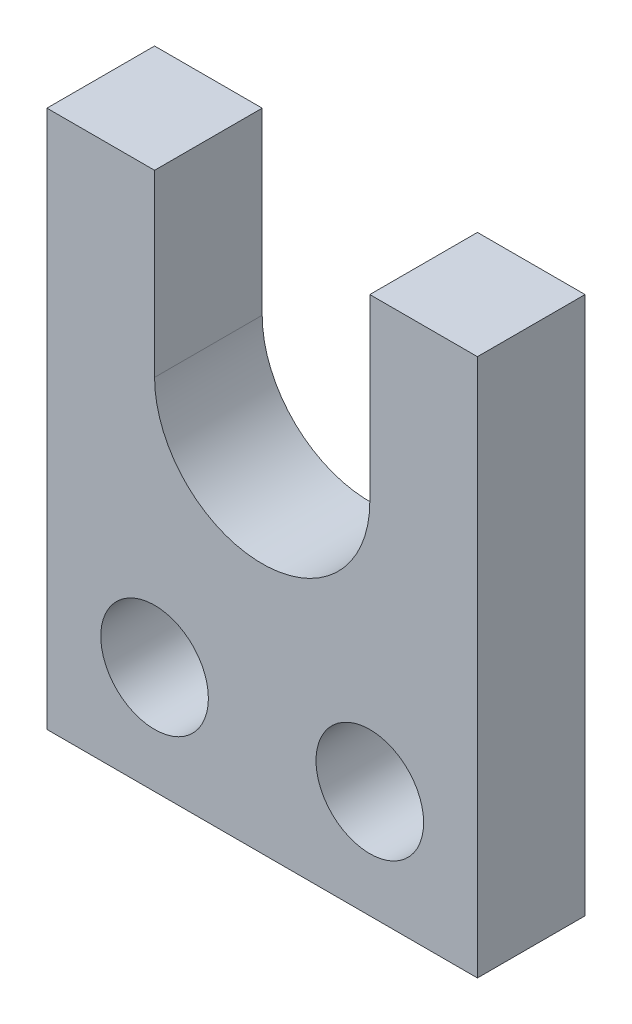
from build123d import *

# Parameters (mm, degrees)
SKETCH1_W           = 12
SKETCH1_H           = 15
SKETCH1_R           = 1.5
BOSS_EXTRUDE1_DEPTH = 3
CUT_EXTRUDE1_REACH  = 12.062


with BuildPart() as part:
    # Sketch1 → Boss-Extrude1 (new body)
    with BuildSketch(Plane.XY):
        Rectangle(SKETCH1_W, SKETCH1_H)
        with Locations((-3, -4.5)):
            Circle(SKETCH1_R, mode=Mode.SUBTRACT)
        with Locations((3, -4.5)):
            Circle(SKETCH1_R, mode=Mode.SUBTRACT)
    extrude(amount=BOSS_EXTRUDE1_DEPTH)

    # Sketch2 → Cut-Extrude1 (cut, up to next)
    with BuildSketch(Plane.XY.offset(3), mode=Mode.PRIVATE) as cut_extrude1_sk1:
        with BuildLine():
            Line((-3, 7.5), (3, 7.5))
            Line((3, 7.5), (3, 2.5))
            ThreePointArc((3, 2.5), (0, -0.5), (-3, 2.5))
            Line((-3, 2.5), (-3, 7.5))
        make_face()
    cut_extrude1_tool1 = extrude(cut_extrude1_sk1.sketch, amount=-CUT_EXTRUDE1_REACH, mode=Mode.PRIVATE) & part.part
    add(cut_extrude1_tool1.solids().sort_by_distance((0, 3.791429, 3))[0], mode=Mode.SUBTRACT)


solid = part.part
